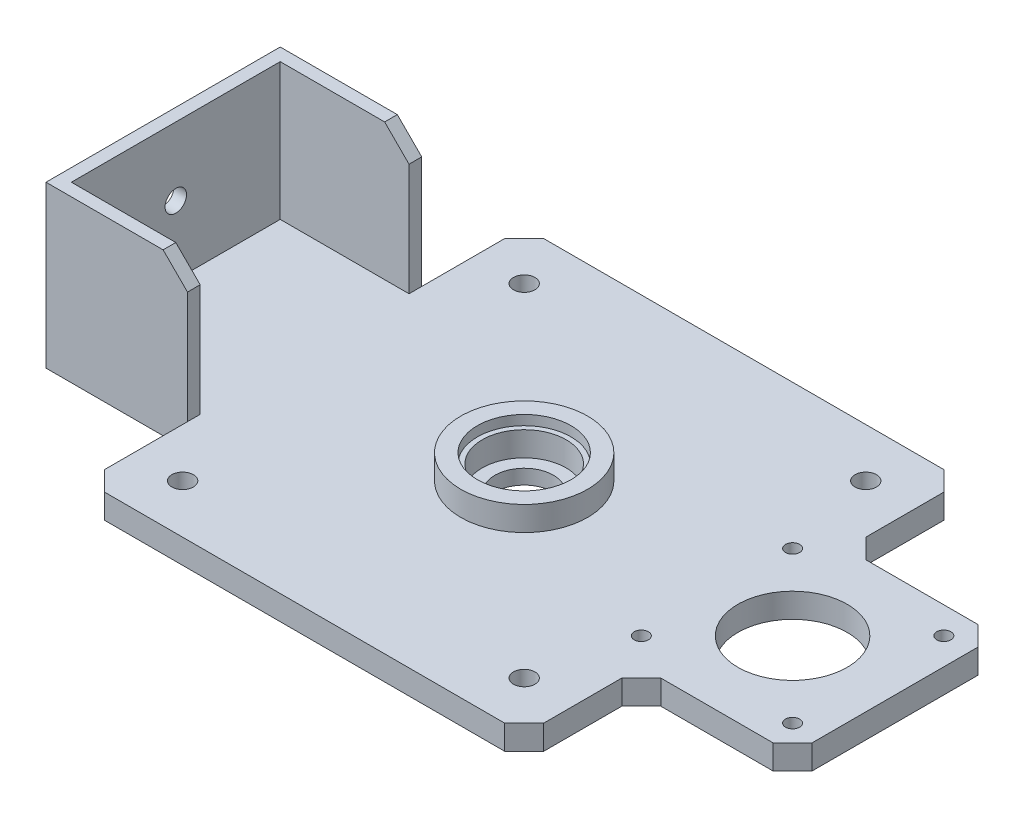
from build123d import *

# Parameters (mm, degrees)
SKETCH1_R           = 2.2
SKETCH1_R_2         = 1.45
SKETCH1_R_3         = 13
SKETCH1_R_4         = 11.2
BOSS_EXTRUDE1_DEPTH = 5
BOSS_EXTRUDE2_DEPTH = 33
SKETCH1_4_R         = 13
SKETCH1_4_R_2       = 6
BOSS_EXTRUDE3_DEPTH = 3
SKETCH1_5_R         = 13
SKETCH1_5_R_2       = 8.6
BOSS_EXTRUDE4_DEPTH = 8
SKETCH1_6_R         = 13
SKETCH1_6_R_2       = 9.6
BOSS_EXTRUDE5_DEPTH = 10
SKETCH2_R           = 2.2
CUT_EXTRUDE1_DEPTH  = 10
CHAMFER1_SIZE       = 4
CHAMFER2_SIZE       = 5


with BuildPart() as part:
    # Sketch1 → Boss-Extrude1 (new body)
    with BuildSketch(Plane(origin=(0, 0, 0), x_dir=(1, 0, 0), z_dir=(0, 1, 0))):
        Polygon((45, 45), (-45, 45), (-45, 24), (-74, 24), (-74, -24), (-45, -24), (-45, -45), (45, -45), (45, -21), (76, -21), (76, 21), (45, 21), align=None)
        with Locations((-35, -35)):
            Circle(SKETCH1_R, mode=Mode.SUBTRACT)
        with Locations((35, -35)):
            Circle(SKETCH1_R, mode=Mode.SUBTRACT)
        with Locations((39.5, -15.5)):
            Circle(SKETCH1_R_2, mode=Mode.SUBTRACT)
        with Locations((70.5, -15.5)):
            Circle(SKETCH1_R_2, mode=Mode.SUBTRACT)
        Circle(SKETCH1_R_3, mode=Mode.SUBTRACT)
        with Locations((-35, 35)):
            Circle(SKETCH1_R, mode=Mode.SUBTRACT)
        with Locations((55, 0)):
            Circle(SKETCH1_R_4, mode=Mode.SUBTRACT)
        with Locations((39.5, 15.5)):
            Circle(SKETCH1_R_2, mode=Mode.SUBTRACT)
        with Locations((70.5, 15.5)):
            Circle(SKETCH1_R_2, mode=Mode.SUBTRACT)
        with Locations((35, 35)):
            Circle(SKETCH1_R, mode=Mode.SUBTRACT)
    extrude(amount=BOSS_EXTRUDE1_DEPTH)

    # Sketch1<3> → Boss-Extrude2 (add)
    with BuildSketch(Plane(origin=(0, 0, 0), x_dir=(1, 0, 0), z_dir=(0, 1, 0))):
        Polygon((-45, 21.4), (-45, 24), (-74, 24), (-74, -24), (-45, -24), (-45, -21.4), (-71.4, -21.4), (-71.4, 21.4), align=None)
    extrude(amount=BOSS_EXTRUDE2_DEPTH)

    # Sketch1<4> → Boss-Extrude3 (add)
    with BuildSketch(Plane(origin=(0, 0, 0), x_dir=(1, 0, 0), z_dir=(0, 1, 0))):
        Circle(SKETCH1_4_R)
        Circle(SKETCH1_4_R_2, mode=Mode.SUBTRACT)
    extrude(amount=BOSS_EXTRUDE3_DEPTH)

    # Sketch1<5> → Boss-Extrude4 (add)
    with BuildSketch(Plane(origin=(0, 0, 0), x_dir=(1, 0, 0), z_dir=(0, 1, 0))):
        Circle(SKETCH1_5_R)
        Circle(SKETCH1_5_R_2, mode=Mode.SUBTRACT)
    extrude(amount=BOSS_EXTRUDE4_DEPTH)

    # Sketch1<6> → Boss-Extrude5 (add)
    with BuildSketch(Plane(origin=(0, 0, 0), x_dir=(1, 0, 0), z_dir=(0, 1, 0))):
        Circle(SKETCH1_6_R)
        Circle(SKETCH1_6_R_2, mode=Mode.SUBTRACT)
    extrude(amount=BOSS_EXTRUDE5_DEPTH)

    # Sketch2 → Cut-Extrude1 (cut)
    with BuildSketch(Plane(origin=(-71.4, 0, 0), x_dir=(0, 0, -1), z_dir=(1, 0, 0))):
        with Locations((0, 19)):
            Circle(SKETCH2_R)
    extrude(amount=-CUT_EXTRUDE1_DEPTH, mode=Mode.SUBTRACT)

    # Chamfer1
    chamfer1_edges = [part.edges().sort_by_distance(p)[0] for p in [
        (-45, 2.5, 45),
        (-45, 2.5, -45),
        (45, 2.5, -45),
        (45, 2.5, -21),
        (76, 2.5, -21),
        (76, 2.5, 21),
        (45, 2.5, 21),
        (45, 2.5, 45),
    ]]
    chamfer(chamfer1_edges, length=CHAMFER1_SIZE)

    # Chamfer2
    chamfer2_edges = [part.edges().sort_by_distance(p)[0] for p in [
        (-45, 33, -22.7),
        (-45, 33, 22.7),
    ]]
    chamfer(chamfer2_edges, length=CHAMFER2_SIZE)


solid = part.part
